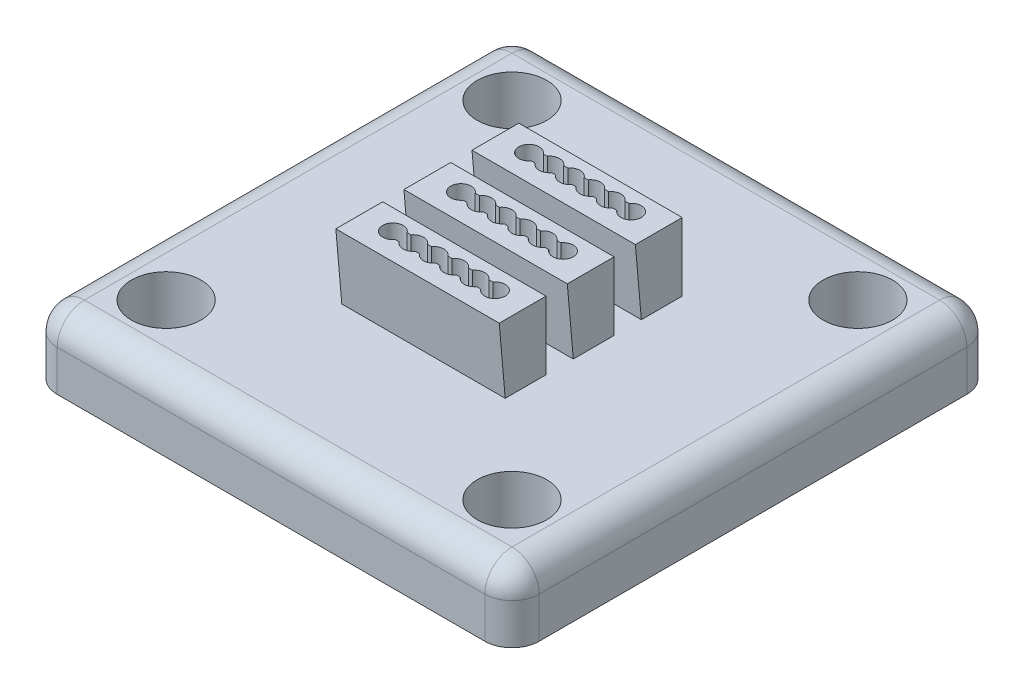
from build123d import *

# Parameters (mm, degrees)
SKETCH1_R           = 2.5527
BOSS_EXTRUDE1_DEPTH = 5
SKETCH1_3_W         = 12
SKETCH1_3_H         = 3
BOSS_EXTRUDE2_DEPTH = 10
DRAFT1_ANGLE        = -5
DRAFT2_ANGLE        = -5
DRAFT3_ANGLE        = -5
FILLET1_R           = 2


with BuildPart() as part:
    # Sketch1 → Boss-Extrude1 (new body)
    with BuildSketch(Plane(origin=(0, 0, 0), x_dir=(1, 0, 0), z_dir=(0, 1, 0))):
        with BuildLine():
            Line((-17.428483445, 16.107274833), (-17.428483445, -15.292725167))
            ThreePointArc((-17.428483445, -15.292725167), (-16.842697007, -16.706938729), (-15.428483445, -17.292725167))
            Line((-15.428483445, -17.292725167), (15.971516555, -17.292725167))
            ThreePointArc((15.971516555, -17.292725167), (17.385730118, -16.706938729), (17.971516555, -15.292725167))
            Line((17.971516555, -15.292725167), (17.971516555, 16.107274833))
            ThreePointArc((17.971516555, 16.107274833), (17.385730118, 17.521488395), (15.971516555, 18.107274833))
            Line((15.971516555, 18.107274833), (-15.428483445, 18.107274833))
            ThreePointArc((-15.428483445, 18.107274833), (-16.842697007, 17.521488395), (-17.428483445, 16.107274833))
        make_face()
        with Locations((-12.428483445, -12.292725167)):
            Circle(SKETCH1_R, mode=Mode.SUBTRACT)
        with Locations((-12.428483445, 13.107274833)):
            Circle(SKETCH1_R, mode=Mode.SUBTRACT)
        with Locations((12.971516555, 13.107274833)):
            Circle(SKETCH1_R, mode=Mode.SUBTRACT)
        with Locations((12.971516555, -12.292725167)):
            Circle(SKETCH1_R, mode=Mode.SUBTRACT)
    extrude(amount=BOSS_EXTRUDE1_DEPTH)

    # Sketch1<3> → Boss-Extrude2 (add)
    # profile 1 of 3: a face of its own
    with BuildSketch(Plane(origin=(0, 0, 0), x_dir=(1, 0, 0), z_dir=(0, 1, 0))):
        with Locations((0.271516555, -4.592725167)):
            Rectangle(SKETCH1_3_W, SKETCH1_3_H)
        with BuildLine():
            ThreePointArc((3.421516555, -5.042725167), (3.271516555, -5.032064995), (3.121516555, -5.042725167))
            ThreePointArc((3.121516555, -5.042725167), (2.521516555, -5.342725167), (1.921516555, -5.042725167))
            ThreePointArc((1.921516555, -5.042725167), (1.771516555, -5.032064995), (1.621516555, -5.042725167))
            ThreePointArc((1.621516555, -5.042725167), (1.021516555, -5.342725167), (0.421516555, -5.042725167))
            ThreePointArc((0.421516555, -5.042725167), (0.271516555, -5.032064995), (0.121516555, -5.042725167))
            ThreePointArc((0.121516555, -5.042725167), (-0.478483445, -5.342725167), (-1.078483445, -5.042725167))
            ThreePointArc((-1.078483445, -5.042725167), (-1.228483445, -5.032064995), (-1.378483445, -5.042725167))
            ThreePointArc((-1.378483445, -5.042725167), (-1.978483445, -5.342725167), (-2.578483445, -5.042725167))
            ThreePointArc((-2.578483445, -5.042725167), (-2.728483445, -5.032064995), (-2.878483445, -5.042725167))
            ThreePointArc((-2.878483445, -5.042725167), (-4.228483445, -4.592725167), (-2.878483445, -4.142725167))
            ThreePointArc((-2.878483445, -4.142725167), (-2.728483445, -4.153385339), (-2.578483445, -4.142725167))
            ThreePointArc((-2.578483445, -4.142725167), (-1.978483445, -3.842725167), (-1.378483445, -4.142725167))
            ThreePointArc((-1.378483445, -4.142725167), (-1.228483445, -4.153385339), (-1.078483445, -4.142725167))
            ThreePointArc((-1.078483445, -4.142725167), (-0.478483445, -3.842725167), (0.121516555, -4.142725167))
            ThreePointArc((0.121516555, -4.142725167), (0.271516555, -4.153385339), (0.421516555, -4.142725167))
            ThreePointArc((0.421516555, -4.142725167), (1.021516555, -3.842725167), (1.621516555, -4.142725167))
            ThreePointArc((1.621516555, -4.142725167), (1.771516555, -4.153385339), (1.921516555, -4.142725167))
            ThreePointArc((1.921516555, -4.142725167), (2.521516555, -3.842725167), (3.121516555, -4.142725167))
            ThreePointArc((3.121516555, -4.142725167), (3.271516555, -4.153385339), (3.421516555, -4.142725167))
            ThreePointArc((3.421516555, -4.142725167), (4.771516555, -4.592725167), (3.421516555, -5.042725167))
        make_face(mode=Mode.SUBTRACT)
    # profile 2 of 3: a face of its own
    with BuildSketch(Plane(origin=(0, 0, 0), x_dir=(1, 0, 0), z_dir=(0, 1, 0))):
        with Locations((0.271516555, 0.407274833)):
            Rectangle(SKETCH1_3_W, SKETCH1_3_H)
        with BuildLine():
            ThreePointArc((3.421516555, -0.042725167), (3.271516555, -0.032064995), (3.121516555, -0.042725167))
            ThreePointArc((3.121516555, -0.042725167), (2.521516555, -0.342725167), (1.921516555, -0.042725167))
            ThreePointArc((1.921516555, -0.042725167), (1.771516555, -0.032064995), (1.621516555, -0.042725167))
            ThreePointArc((1.621516555, -0.042725167), (1.021516555, -0.342725167), (0.421516555, -0.042725167))
            ThreePointArc((0.421516555, -0.042725167), (0.271516555, -0.032064995), (0.121516555, -0.042725167))
            ThreePointArc((0.121516555, -0.042725167), (-0.478483445, -0.342725167), (-1.078483445, -0.042725167))
            ThreePointArc((-1.078483445, -0.042725167), (-1.228483445, -0.032064995), (-1.378483445, -0.042725167))
            ThreePointArc((-1.378483445, -0.042725167), (-1.978483445, -0.342725167), (-2.578483445, -0.042725167))
            ThreePointArc((-2.578483445, -0.042725167), (-2.728483445, -0.032064995), (-2.878483445, -0.042725167))
            ThreePointArc((-2.878483445, -0.042725167), (-4.228483445, 0.407274833), (-2.878483445, 0.857274833))
            ThreePointArc((-2.878483445, 0.857274833), (-2.728483445, 0.846614661), (-2.578483445, 0.857274833))
            ThreePointArc((-2.578483445, 0.857274833), (-1.978483445, 1.157274833), (-1.378483445, 0.857274833))
            ThreePointArc((-1.378483445, 0.857274833), (-1.228483445, 0.846614661), (-1.078483445, 0.857274833))
            ThreePointArc((-1.078483445, 0.857274833), (-0.478483445, 1.157274833), (0.121516555, 0.857274833))
            ThreePointArc((0.121516555, 0.857274833), (0.271516555, 0.846614661), (0.421516555, 0.857274833))
            ThreePointArc((0.421516555, 0.857274833), (1.021516555, 1.157274833), (1.621516555, 0.857274833))
            ThreePointArc((1.621516555, 0.857274833), (1.771516555, 0.846614661), (1.921516555, 0.857274833))
            ThreePointArc((1.921516555, 0.857274833), (2.521516555, 1.157274833), (3.121516555, 0.857274833))
            ThreePointArc((3.121516555, 0.857274833), (3.271516555, 0.846614661), (3.421516555, 0.857274833))
            ThreePointArc((3.421516555, 0.857274833), (4.771516555, 0.407274833), (3.421516555, -0.042725167))
        make_face(mode=Mode.SUBTRACT)
    # profile 3 of 3: a face of its own
    with BuildSketch(Plane(origin=(0, 0, 0), x_dir=(1, 0, 0), z_dir=(0, 1, 0))):
        with Locations((0.271516555, 5.407274833)):
            Rectangle(SKETCH1_3_W, SKETCH1_3_H)
        with BuildLine():
            ThreePointArc((1.621516555, 4.957274833), (1.021516555, 4.657274833), (0.421516555, 4.957274833))
            ThreePointArc((0.421516555, 4.957274833), (0.271516555, 4.967935005), (0.121516555, 4.957274833))
            ThreePointArc((0.121516555, 4.957274833), (-0.478483445, 4.657274833), (-1.078483445, 4.957274833))
            ThreePointArc((-1.078483445, 4.957274833), (-1.228483445, 4.967935005), (-1.378483445, 4.957274833))
            ThreePointArc((-1.378483445, 4.957274833), (-1.978483445, 4.657274833), (-2.578483445, 4.957274833))
            ThreePointArc((-2.578483445, 4.957274833), (-2.728483445, 4.967935005), (-2.878483445, 4.957274833))
            ThreePointArc((-2.878483445, 4.957274833), (-4.228483445, 5.407274833), (-2.878483445, 5.857274833))
            ThreePointArc((-2.878483445, 5.857274833), (-2.728483445, 5.846614661), (-2.578483445, 5.857274833))
            ThreePointArc((-2.578483445, 5.857274833), (-1.978483445, 6.157274833), (-1.378483445, 5.857274833))
            ThreePointArc((-1.378483445, 5.857274833), (-1.228483445, 5.846614661), (-1.078483445, 5.857274833))
            ThreePointArc((-1.078483445, 5.857274833), (-0.478483445, 6.157274833), (0.121516555, 5.857274833))
            ThreePointArc((0.121516555, 5.857274833), (0.271516555, 5.846614661), (0.421516555, 5.857274833))
            ThreePointArc((0.421516555, 5.857274833), (1.021516555, 6.157274833), (1.621516555, 5.857274833))
            ThreePointArc((1.621516555, 5.857274833), (1.771516555, 5.846614661), (1.921516555, 5.857274833))
            ThreePointArc((1.921516555, 5.857274833), (2.521516555, 6.157274833), (3.121516555, 5.857274833))
            ThreePointArc((3.121516555, 5.857274833), (3.271516555, 5.846614661), (3.421516555, 5.857274833))
            ThreePointArc((3.421516555, 5.857274833), (4.771516555, 5.407274833), (3.421516555, 4.957274833))
            ThreePointArc((3.421516555, 4.957274833), (3.271516555, 4.967935005), (3.121516555, 4.957274833))
            ThreePointArc((3.121516555, 4.957274833), (2.521516555, 4.657274833), (1.921516555, 4.957274833))
            ThreePointArc((1.921516555, 4.957274833), (1.771516555, 4.967935005), (1.621516555, 4.957274833))
        make_face(mode=Mode.SUBTRACT)
    extrude(amount=BOSS_EXTRUDE2_DEPTH)

    # Draft1
    draft1_faces = [part.faces().sort_by_distance(p)[0] for p in [
        (0.271516555, 7.5, 6.092725167),
    ]]
    draft(draft1_faces, Plane.ZX.offset(5), DRAFT1_ANGLE)

    # Draft2
    draft2_faces = [part.faces().sort_by_distance(p)[0] for p in [
        (0.271516555, 7.5, 1.092725167),
    ]]
    draft(draft2_faces, Plane.ZX.offset(5), DRAFT2_ANGLE)

    # Draft3
    draft3_faces = [part.faces().sort_by_distance(p)[0] for p in [
        (0.271516555, 7.5, -3.907274833),
    ]]
    draft(draft3_faces, Plane.ZX.offset(5), DRAFT3_ANGLE)

    # Fillet1
    fillet1_edges = [part.edges().sort_by_distance(p)[0] for p in [
        (17.385730118, 5, 16.706938729),
        (17.971516555, 5, -0.407274833),
        (17.385730118, 5, -17.521488395),
        (0.271516555, 5, -18.107274833),
        (-16.842697007, 5, -17.521488395),
        (-17.428483445, 5, -0.407274833),
        (-16.842697007, 5, 16.706938729),
        (0.271516555, 5, 17.292725167),
    ]]
    fillet(fillet1_edges, radius=FILLET1_R)


solid = part.part
